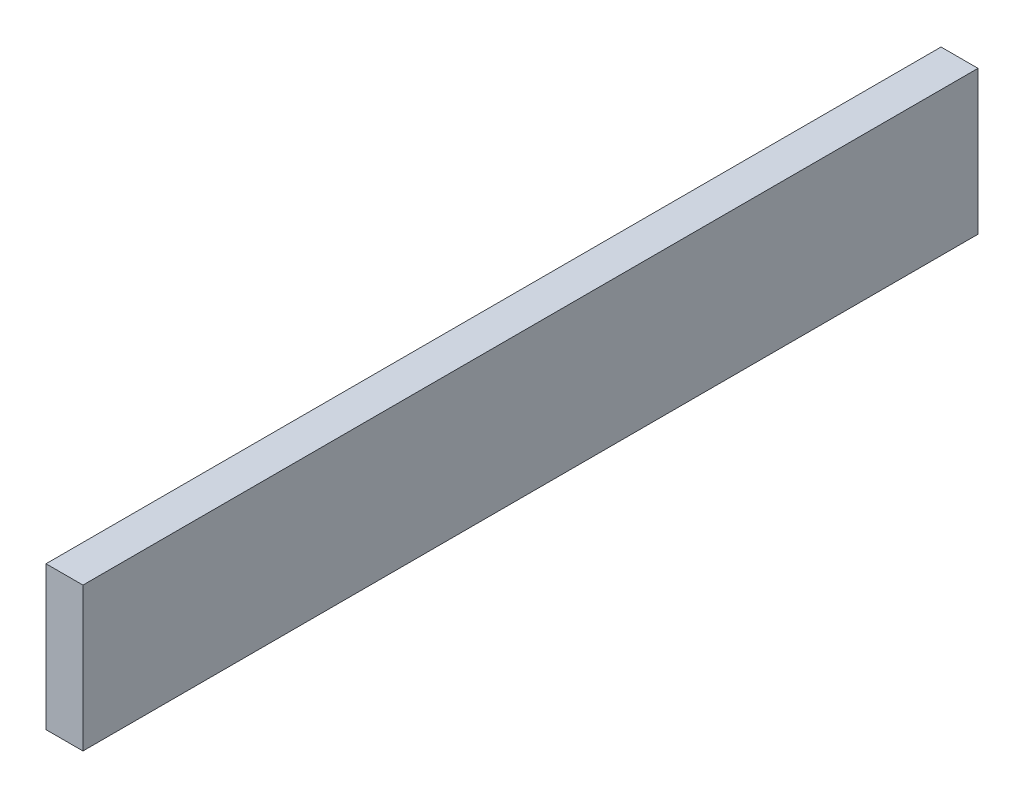
from build123d import *

# Parameters (mm, degrees)
SKETCH1_W           = 436
SKETCH1_H           = 70
BOSS_EXTRUDE1_DEPTH = 18


with BuildPart() as part:
    # Sketch1 → Boss-Extrude1 (new body)
    with BuildSketch(Plane(origin=(0, 0, 0), x_dir=(0, 0, -1), z_dir=(1, 0, 0))):
        with Locations((218, 35)):
            Rectangle(SKETCH1_W, SKETCH1_H)
    extrude(amount=BOSS_EXTRUDE1_DEPTH)


solid = part.part
